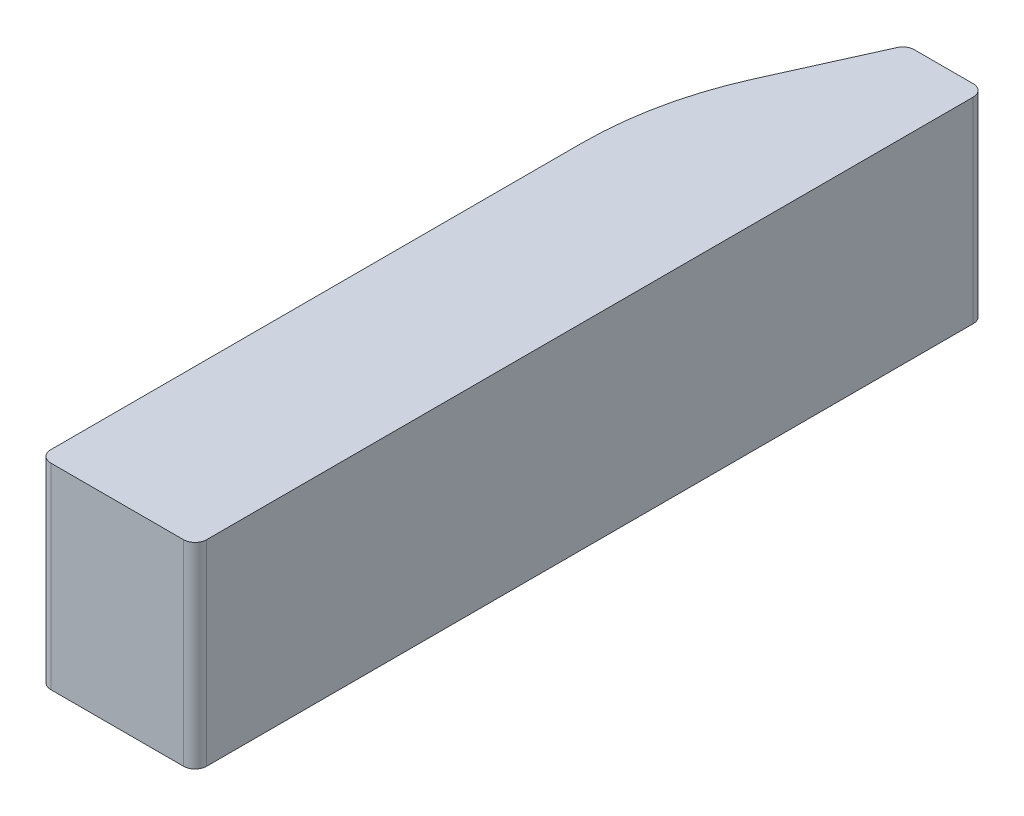
from build123d import *

# Parameters (mm, degrees)
SKETCH_1_W          = 13.5
SKETCH_1_H          = 68.4
EXTRUDE_1_DEPTH     = 17
SKETCH_2_R          = 2.75
CUT_EXTRUDE_1_DEPTH = 5
CUT_EXTRUDE_2_DEPTH = 17
EXTRUDE_2_DEPTH     = 5.5
FILLET_1_R          = 30
FILLET_2_R          = 1
SKETCH_8_W          = 4
SKETCH_8_H          = 19.960959335
CUT_EXTRUDE_5_DEPTH = 17


with BuildPart() as part:
    # ｽｹｯﾁ1 → ﾎﾞｽ - 押し出し1 (new body)
    with BuildSketch(Plane(origin=(0, 0, 0), x_dir=(1, 0, 0), z_dir=(0, 1, 0))):
        with Locations((6.75, 34.2)):
            Rectangle(SKETCH_1_W, SKETCH_1_H)
    extrude(amount=EXTRUDE_1_DEPTH)

    # ｽｹｯﾁ2 → ｶｯﾄ - 押し出し1 (cut)
    with BuildSketch(Plane.XZ):
        with Locations(Location((8.5, -47.4, 0), (0, 0, 270))):
            Circle(SKETCH_2_R)
        with Locations(Location((8.5, -11, 0), (0, 0, 90))):
            Circle(SKETCH_2_R)
    extrude(amount=-CUT_EXTRUDE_1_DEPTH, mode=Mode.SUBTRACT)

    # ｽｹｯﾁ3 → ｶｯﾄ - 押し出し2 (cut)
    with BuildSketch(Plane(origin=(0, 17, 0), x_dir=(1, 0, 0), z_dir=(0, 1, 0))):
        Polygon((6.75, 68.4), (0, 68.4), (0, 53.4), align=None)
    extrude(amount=-CUT_EXTRUDE_2_DEPTH, mode=Mode.SUBTRACT)

    # ｽｹｯﾁ4 → ﾎﾞｽ - 押し出し2 (add)
    with BuildSketch(Plane.XZ):
        Polygon((0, -47), (-4, -37), (-4, -27), (0, -27), align=None)
    extrude(amount=-EXTRUDE_2_DEPTH)

    # ﾌｨﾚｯﾄ1
    fillet_1_edges = [part.edges().sort_by_distance(p)[0] for p in [
        (0, 8.5, -53.4),
    ]]
    fillet(fillet_1_edges, radius=FILLET_1_R)

    # ﾌｨﾚｯﾄ2
    fillet_2_edges = [part.edges().sort_by_distance(p)[0] for p in [
        (6.75, 8.5, -68.4),
        (13.5, 8.5, -68.4),
        (13.5, 8.5, 0),
        (0, 8.5, 0),
    ]]
    fillet(fillet_2_edges, radius=FILLET_2_R)

    # ｽｹｯﾁ8 → ｶｯﾄ - 押し出し5 (cut)
    with BuildSketch(Plane(origin=(0, 17, 0), x_dir=(1, 0, 0), z_dir=(0, 1, 0))):
        with Locations((-2, 36.980479668)):
            Rectangle(SKETCH_8_W, SKETCH_8_H)
    extrude(amount=-CUT_EXTRUDE_5_DEPTH, mode=Mode.SUBTRACT)


solid = part.part
